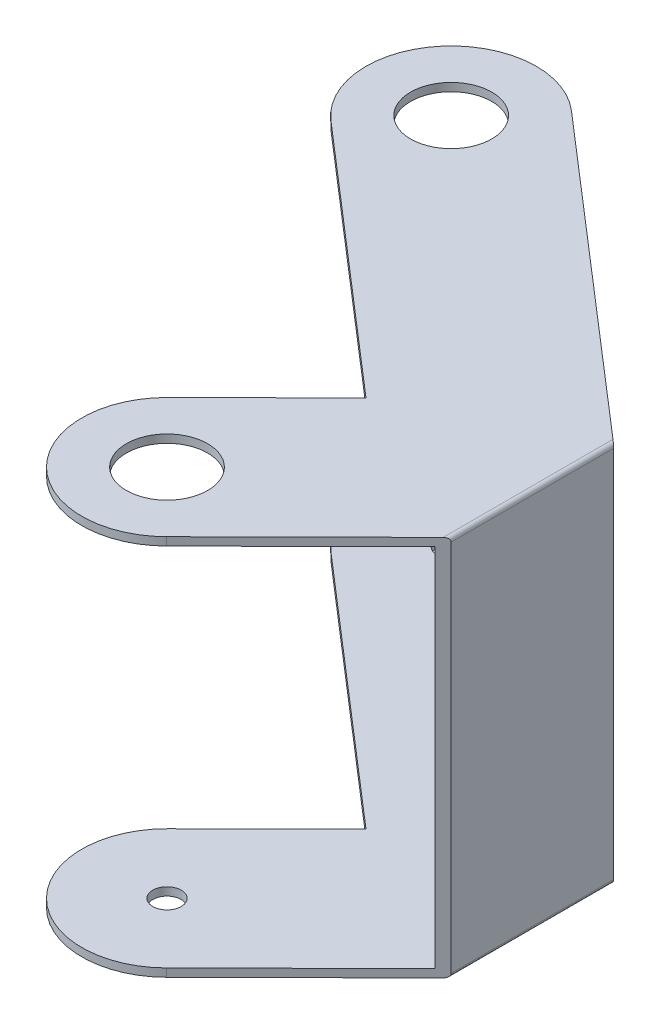
from build123d import *

# Parameters (mm, degrees)
EXTRUDE_1_DEPTH             = 47
SHELL_1_T                   = -1
FILLET_2_R                  = 0.5
HOLE_WIZARD_10_0_10_4_D     = 10
HOLE_WIZARD_10_0_10_4_DEPTH = 1
HOLE_WIZARD_3_5_3_5_1_D     = 3.5


with BuildPart() as part:
    # 草图1 → 凸台-拉伸1 (new body)
    with BuildSketch(Plane(origin=(0, 0, 0), x_dir=(1, 0, 0), z_dir=(0, 1, 0))):
        with BuildLine():
            Line((25, 30), (-13.135780284, 62.94559549))
            ThreePointArc((-13.135780284, 62.94559549), (-27.94559549, 61.864219716), (-26.864219716, 47.05440451))
            Line((-26.864219716, 47.05440451), (4.883538541, 19.627437146))
            Line((4.883538541, 19.627437146), (-7.392601402, 7.456503505))
            ThreePointArc((-7.392601402, 7.456503505), (-7.456503505, -7.392601402), (7.392601402, -7.456503505))
            Line((7.392601402, -7.456503505), (25, 10))
            Line((25, 10), (25, 30))
        make_face()
    extrude(amount=EXTRUDE_1_DEPTH)

    # 抽壳1
    shell_1_openings = [part.faces().sort_by_distance(p)[0] for p in [
        (5.932109858, 23.5, -46.472797745),
        (16.196300701, 23.5, -1.271748248),
        (-7.456503505, 23.5, 7.392601402),
        (-1.25453143, 23.5, -13.541970325),
        (-10.990340588, 23.5, -33.340920828),
        (-27.94559549, 23.5, -61.864219716),
    ]]
    offset(amount=SHELL_1_T, openings=shell_1_openings, kind=Kind.INTERSECTION)

    # 圆角2
    fillet_2_edges = [part.edges().sort_by_distance(p)[0] for p in [
        (25, 47, -20),
        (25, 0, -20),
    ]]
    fillet(fillet_2_edges, radius=FILLET_2_R)

    # Ø10.0 (10) 直径槽口4
    with Locations(Plane(origin=(0, 47, 0), x_dir=(1, 0, 0), z_dir=(0, 1, 0))):
        with Locations((0, 0), (-20, 55)):
            Hole(HOLE_WIZARD_10_0_10_4_D / 2, depth=HOLE_WIZARD_10_0_10_4_DEPTH)

    # Ø3.5 (3.5) 直径槽口1 (through all)
    with Locations(Plane(origin=(0, 0, 0), x_dir=(-1, 0, 0), z_dir=(0, -1, 0))):
        with Locations((0, 0), (20, 55)):
            Hole(HOLE_WIZARD_3_5_3_5_1_D / 2)


solid = part.part
